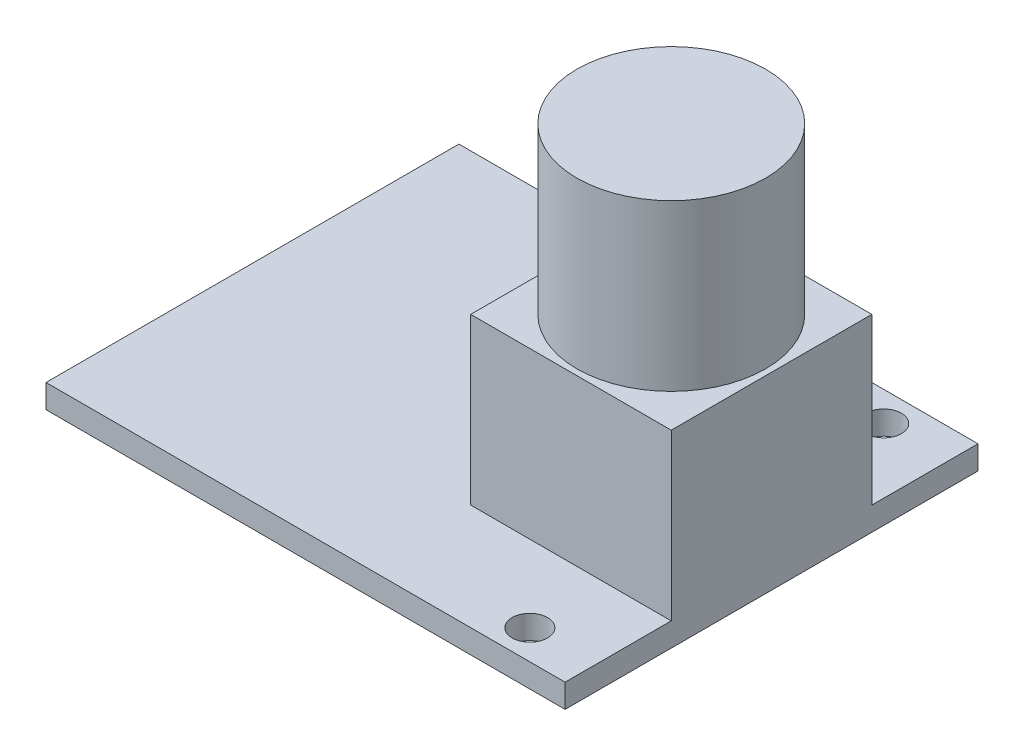
from build123d import *

# Parameters (mm, degrees)
SKETCH_1_W          = 44
SKETCH_1_H          = 35
EXTRUDE_1_DEPTH     = 2
SKETCH_2_W          = 17
SKETCH_2_H          = 17
EXTRUDE_2_DEPTH     = 14
SKETCH_3_R          = 8
EXTRUDE_3_DEPTH     = 14
SKETCH_4_R          = 1.5
CUT_EXTRUDE_1_DEPTH = 10


with BuildPart() as part:
    # 草图1 → 凸台-拉伸1 (new body)
    with BuildSketch(Plane(origin=(0, 0, 0), x_dir=(1, 0, 0), z_dir=(0, 1, 0))):
        Rectangle(SKETCH_1_W, SKETCH_1_H)
    extrude(amount=EXTRUDE_1_DEPTH)

    # 草图2 → 凸台-拉伸2 (add)
    with BuildSketch(Plane(origin=(0, 2, 0), x_dir=(1, 0, 0), z_dir=(0, 1, 0))):
        with Locations((13.5, 0)):
            Rectangle(SKETCH_2_W, SKETCH_2_H)
    extrude(amount=EXTRUDE_2_DEPTH)

    # 草图3 → 凸台-拉伸3 (add)
    with BuildSketch(Plane(origin=(0, 16, 0), x_dir=(1, 0, 0), z_dir=(0, 1, 0))):
        with Locations(Location((13.5, 0, 0), (0, 0, 270))):
            Circle(SKETCH_3_R)
    extrude(amount=EXTRUDE_3_DEPTH)

    # 草图4 → 切除-拉伸1 (cut)
    with BuildSketch(Plane.XZ):
        with Locations(Location((16.511574999, -15, 0), (0, 0, 270))):
            Circle(SKETCH_4_R)
        with Locations(Location((16.511574999, 15, 0), (0, 0, 90))):
            Circle(SKETCH_4_R)
    extrude(amount=-CUT_EXTRUDE_1_DEPTH, mode=Mode.SUBTRACT)


solid = part.part
